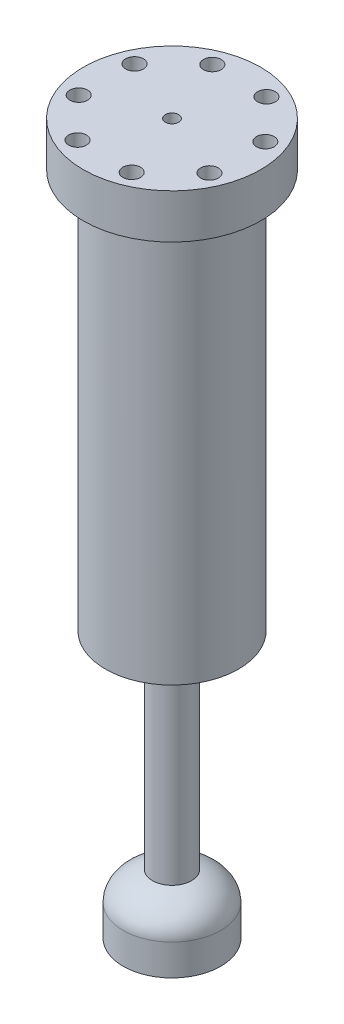
from build123d import *

# Parameters (mm, degrees)
SKETCH3_R          = 0.75
CUT_EXTRUDE1_DEPTH = 75
SKETCH4_R          = 1
CUT_EXTRUDE2_DEPTH = 5


with BuildPart() as part:
    # Sketch1 → Revolve1 (revolve)
    with BuildSketch(Plane(origin=(0, 0, 0), x_dir=(0, 0, -1), z_dir=(1, 0, 0))):
        with BuildLine():
            Line((0, 80), (10, 80))
            Line((10, 80), (10, 75))
            Line((10, 75), (7.5, 75))
            Line((7.5, 75), (7.5, 30))
            Line((7.5, 30), (2.2, 30))
            Line((2.2, 30), (2.2, 6.707802986))
            add(Edge.make_bspline(
                [(5.5, 3.5), (5.5, 5.791287847), (2.2, 6.707802986)],
                knots=[3.141592654, 3.141592654, 3.141592654, 4.300872134, 4.300872134, 4.300872134], degree=2, weights=[1, 0.836660027, 1]))
            Line((5.5, 3.5), (5.5, 0))
            Line((5.5, 0), (4.5, 0))
            Line((4.5, 0), (4.5, 1))
            Line((4.5, 1), (4.5, 3.5))
            add(Edge.make_bspline(
                [(4.5, 3.5), (4.5, 3.697156866), (4.420178962, 4.058188281), (3.970108568, 4.705926092), (3.267562051, 5.215959335), (2.550576032, 5.549361773), (2.137087255, 5.687424721), (1.93239721, 5.744273668)],
                knots=[3.141592654, 3.141592654, 3.141592654, 3.141592654, 3.431412524, 3.721232394, 4.011052264, 4.155962199, 4.300872134, 4.300872134, 4.300872134, 4.300872134], degree=3))
            Line((1.93239721, 5.744273668), (0, 5.744273668))
            Line((0, 5.744273668), (0, 80))
        make_face()
    revolve(axis=Axis((0, 5.744273668, 0), (0, 1, 0)))

    # Sketch3 → Cut-Extrude1 (cut)
    with BuildSketch(Plane.XZ.offset(-5.744273668)):
        with Locations(Location((0, 0, 0), (0, 0, 270))):
            Circle(SKETCH3_R)
    extrude(amount=-CUT_EXTRUDE1_DEPTH, mode=Mode.SUBTRACT)

    # Sketch4 → Cut-Extrude2 (cut)
    with BuildSketch(Plane(origin=(0, 80, 0), x_dir=(1, 0, 0), z_dir=(0, 1, 0))):
        with Locations(Location((-2.985595387, 7.528271622, 0), (0, 0, 270))):
            Circle(SKETCH4_R)
        with Locations(Location((3.212157171, 7.434426659, 0), (0, 0, 270))):
            Circle(SKETCH4_R)
        with Locations(Location((7.528271622, 2.985595387, 0), (0, 0, 270))):
            Circle(SKETCH4_R)
        with Locations(Location((7.434426659, -3.212157171, 0), (0, 0, 270))):
            Circle(SKETCH4_R)
        with Locations(Location((2.985595387, -7.528271622, 0), (0, 0, 270))):
            Circle(SKETCH4_R)
        with Locations(Location((-3.212157171, -7.434426659, 0), (0, 0, 270))):
            Circle(SKETCH4_R)
        with Locations(Location((-7.528271622, -2.985595387, 0), (0, 0, 270))):
            Circle(SKETCH4_R)
        with Locations(Location((-7.434426659, 3.212157171, 0), (0, 0, 270))):
            Circle(SKETCH4_R)
    extrude(amount=-CUT_EXTRUDE2_DEPTH, mode=Mode.SUBTRACT)


solid = part.part
